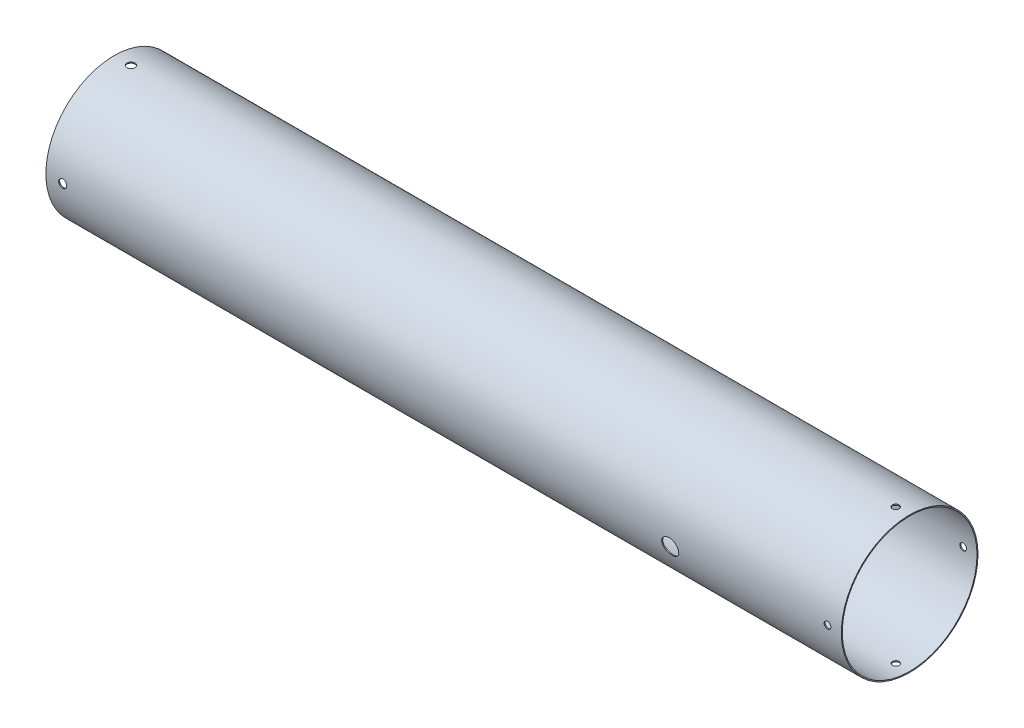
from build123d import *

# Parameters (mm, degrees)
SKETCH1_R               = 51.562
SKETCH1_R_2             = 50.8
BOSS_EXTRUDE1_DEPTH     = 300
CUT_EXTRUDE1_DEPTH      = 309.73496674
CUT_EXTRUDE1_DEPTH_BACK = 309.73496674
SKETCH3_R               = 6.35
SKETCH4_R               = 3.048
SKETCH4_R_2             = 2.54
CUT_EXTRUDE2_DEPTH      = 309.734966871
CIRPATTERN1_COUNT       = 2
CIRPATTERN1_ANGLE       = 90


with BuildPart() as part:
    # Sketch1 → Boss-Extrude1 (new, symmetric)
    with BuildSketch(Plane(origin=(0, 0, 0), x_dir=(0, 0, -1), z_dir=(1, 0, 0))):
        Circle(SKETCH1_R)
        Circle(SKETCH1_R_2, mode=Mode.SUBTRACT)
    extrude(amount=BOSS_EXTRUDE1_DEPTH, both=True)

    # Sketch3 → Cut-Extrude1 (cut, two sides: drawn at the far end of the back side and taken through both)
    with BuildSketch(Plane.XY.offset(-CUT_EXTRUDE1_DEPTH_BACK)):
        with Locations((170.180000052, -8.89)):
            Circle(SKETCH3_R)
    extrude(amount=CUT_EXTRUDE1_DEPTH + CUT_EXTRUDE1_DEPTH_BACK, mode=Mode.SUBTRACT)

    # Sketch4 → Cut-Extrude2 (cut, symmetric)
    with BuildSketch(Plane.XY):
        with Locations((-287.3, 0)):
            Circle(SKETCH4_R)
        with Locations((289.586, 0)):
            Circle(SKETCH4_R_2)
    cut_extrude2 = extrude(amount=CUT_EXTRUDE2_DEPTH, both=True, mode=Mode.SUBTRACT)

    # CirPattern1: Cut-Extrude2 ×2 about axis
    cirpattern1_axis = Axis((300, 0, 0), (-1, 0, 0))
    for i in range(1, CIRPATTERN1_COUNT):
        add(cut_extrude2.rotate(cirpattern1_axis, i * CIRPATTERN1_ANGLE / (CIRPATTERN1_COUNT - 1)), mode=Mode.SUBTRACT)


solid = part.part
